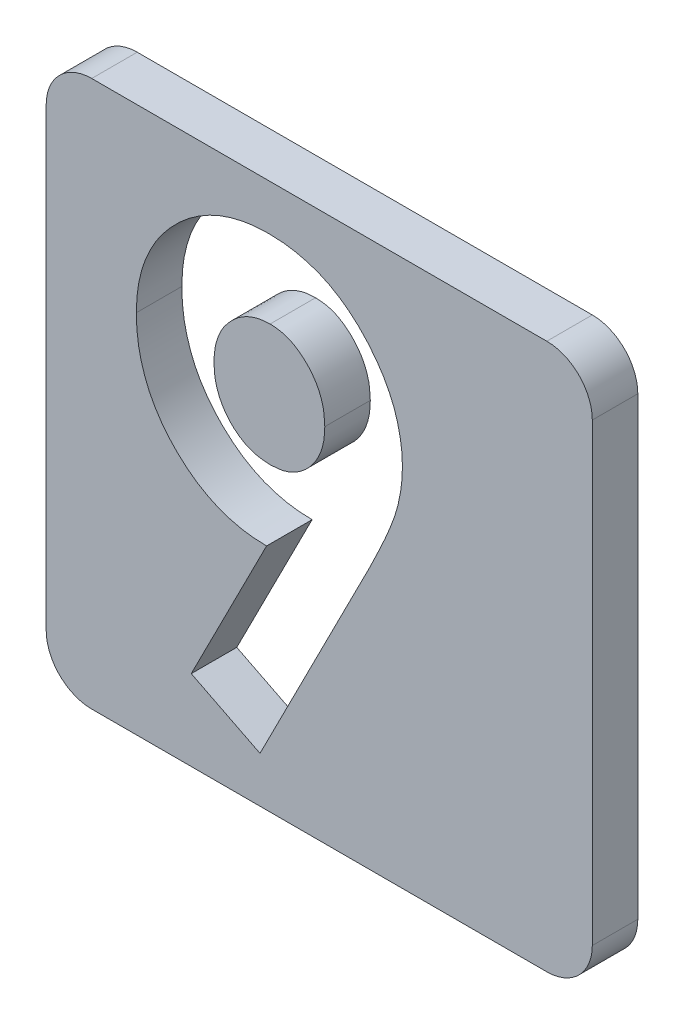
from build123d import *

# Parameters (mm, degrees)
BOSS_EXTRUDE1_DEPTH = 10
CUT_EXTRUDE8_DEPTH  = 10


with BuildPart() as part:
    # Sketch1 → Boss-Extrude1 (new body)
    with BuildSketch(Plane.XY):
        with BuildLine():
            Line((-50, 60), (50, 60))
            ThreePointArc((50, 60), (57.071067812, 57.071067812), (60, 50))
            Line((60, 50), (60, -50))
            ThreePointArc((60, -50), (57.071067812, -57.071067812), (50, -60))
            Line((50, -60), (-50, -60))
            ThreePointArc((-50, -60), (-57.071067812, -57.071067812), (-60, -50))
            Line((-60, -50), (-60, 50))
            ThreePointArc((-60, 50), (-57.071067812, 57.071067812), (-50, 60))
        make_face()
    extrude(amount=BOSS_EXTRUDE1_DEPTH)

    # Sketch2 → Cut-Extrude8 (cut)
    with BuildSketch(Plane.XY.offset(10)):
        with BuildLine():
            Line((-13.016826923, -49.935897436), (-28.127003205, -42.323717949))
            Line((-28.127003205, -42.323717949), (-11.570512821, -9.743589744))
            add(Edge.make_bspline(
                [(-11.570512821, -9.743589744), (-12.548708278, -9.718656842), (-14.469142635, -9.669707523), (-17.296832406, -9.262939126), (-20.000884053, -8.568559514), (-22.613169441, -7.64416532), (-25.097561488, -6.404919118), (-27.484185435, -4.925943808), (-29.740002339, -3.148976233), (-31.875588777, -1.151591204), (-33.825447448, 1.056165786), (-35.517883527, 3.430571064), (-36.993036242, 5.911392925), (-38.140195905, 8.554637717), (-39.061600382, 11.311041924), (-39.734824953, 14.194872996), (-40.112620777, 17.218783333), (-40.165425938, 19.276823637), (-40.192307692, 20.324519231)],
                knots=[0, 0, 0, 0, 1.014336294, 1.991387562, 2.955278539, 3.906441712, 4.859855302, 5.829322156, 6.813833455, 7.833278715, 8.858926674, 9.863225732, 10.85404919, 11.846815163, 12.845559416, 13.865450493, 14.913355531, 16, 16, 16, 16], degree=3))
            add(Edge.make_bspline(
                [(-40.192307692, 20.324519231), (-40.1673734, 21.340773633), (-40.118240892, 23.343281906), (-39.710190668, 26.282312375), (-39.038645608, 29.104211007), (-38.117309844, 31.808498403), (-36.890777483, 34.376939083), (-35.455152573, 36.849748868), (-33.70016626, 39.175767992), (-31.717628771, 41.365065794), (-29.547846705, 43.367886729), (-27.245890069, 45.128855775), (-24.822225522, 46.600856692), (-22.307999558, 47.837065907), (-19.657765713, 48.76068453), (-16.909822836, 49.457547936), (-14.043700567, 49.859737715), (-12.098236548, 49.910307721), (-11.113782051, 49.935897436)],
                knots=[0, 0, 0, 0, 1.055538678, 2.079917126, 3.075849687, 4.065898488, 5.041806164, 6.028602842, 7.031727914, 8.062953097, 9.093756959, 10.095582084, 11.068815425, 12.035667573, 13.000833448, 13.979119574, 14.977382875, 16, 16, 16, 16], degree=3))
            add(Edge.make_bspline(
                [(-11.113782051, 49.935897436), (-10.084415788, 49.914709044), (-8.060306309, 49.873044939), (-5.097281847, 49.413297973), (-2.262379974, 48.707962029), (0.455917975, 47.749971924), (3.023865475, 46.449781068), (5.462949791, 44.891493271), (7.765057752, 43.040630392), (9.905466416, 40.950540036), (11.852144175, 38.677175718), (13.577631788, 36.297511709), (15.027114637, 33.816200927), (16.214329754, 31.255388219), (17.139164354, 28.611061763), (17.774870277, 25.87947069), (18.196908504, 23.065286139), (18.244928031, 21.15706104), (18.269230769, 20.19130609)],
                knots=[0, 0, 0, 0, 1.062826075, 2.08990367, 3.089830715, 4.078784409, 5.060762809, 6.057138927, 7.064407536, 8.107320944, 9.143871033, 10.153461498, 11.140480137, 12.108246174, 13.065926856, 14.029354859, 15.002654194, 16, 16, 16, 16], degree=3))
            add(Edge.make_bspline(
                [(18.269230769, 20.19130609), (18.255968539, 19.454747721), (18.229255424, 17.971153561), (17.966591792, 15.746343301), (17.568078138, 13.515366757), (17.105518687, 11.639668813), (16.620589451, 10.058569374), (16.14869808, 8.71729972), (15.54324756, 7.228238571), (14.867201538, 5.581405091), (14.084260677, 3.784020843), (13.178192139, 1.844678009), (12.203756224, -0.265385795), (11.485500766, -1.708218659), (11.113782051, -2.454927885)],
                knots=[0, 0, 0, 0, 1.105131805, 2.225983929, 3.357782449, 4.505488967, 5.122909461, 5.839607681, 6.638776516, 7.535249922, 8.51168636, 9.581005249, 10.748097757, 12, 12, 12, 12], degree=3))
            Line((11.113782051, -2.454927885), (-13.016826923, -49.935897436))
        make_face()
        with BuildLine():
            add(Edge.make_bspline(
                [(-10.733173077, 6.08974359), (-9.916146682, 6.137844301), (-8.319862096, 6.2318222), (-6.026905446, 6.958479343), (-3.974825826, 8.201987058), (-2.155993164, 9.85400362), (-0.652965525, 11.869539394), (0.439833923, 14.164047711), (1.112964745, 16.690011833), (1.182281853, 18.448924336), (1.217948718, 19.353966346)],
                knots=[0, 0, 0, 0, 0.984774978, 1.924027336, 2.867853169, 3.859505234, 4.871392407, 5.881338128, 6.909850265, 8, 8, 8, 8], degree=3))
            add(Edge.make_bspline(
                [(1.217948718, 19.353966346), (1.174991867, 20.277835319), (1.091430535, 22.074981053), (0.411851392, 24.661577988), (-0.749412668, 26.999708209), (-2.329245998, 29.032187271), (-4.173680809, 30.733112591), (-6.236224491, 31.975592732), (-8.466794198, 32.743902628), (-10.010426476, 32.837387258), (-10.790264423, 32.884615385)],
                knots=[0, 0, 0, 0, 1.104110315, 2.147758178, 3.172670271, 4.206310416, 5.210906102, 6.157051016, 7.068948237, 8, 8, 8, 8], degree=3))
            add(Edge.make_bspline(
                [(-10.790264423, 32.884615385), (-11.614509362, 32.838574056), (-13.232907553, 32.748172283), (-15.554343685, 31.981707424), (-17.694343378, 30.763087041), (-19.563156483, 29.05639056), (-21.180542563, 27.050678592), (-22.30839003, 24.704656139), (-23.021905441, 22.136109489), (-23.10060496, 20.3357409), (-23.141025641, 19.411057692)],
                knots=[0, 0, 0, 0, 0.970967322, 1.90648639, 2.855811969, 3.858352357, 4.877096915, 5.878517833, 6.91039038, 8, 8, 8, 8], degree=3))
            add(Edge.make_bspline(
                [(-23.141025641, 19.411057692), (-23.098803739, 18.499555164), (-23.016686547, 16.726777924), (-22.328460975, 14.186488067), (-21.20741048, 11.879837023), (-19.67485448, 9.848405883), (-17.787122896, 8.188249657), (-15.643749014, 6.957987809), (-13.252865032, 6.229851869), (-11.588189493, 6.137287052), (-10.733173077, 6.08974359)],
                knots=[0, 0, 0, 0, 1.075706617, 2.092137047, 3.084482865, 4.090466434, 5.0784141, 6.035155512, 6.990809768, 8, 8, 8, 8], degree=3))
        make_face(mode=Mode.SUBTRACT)
    extrude(amount=-CUT_EXTRUDE8_DEPTH, mode=Mode.SUBTRACT)


with BuildPart() as cut_extrude8_piece_1:
    # of the separate pieces the step leaves, piece 1, a body of its own (cut_extrude8_pieces)
    add(part.part.solids().sort_by_distance((-50, 60, 0))[0])


with BuildPart() as cut_extrude8_piece_2:
    # of the separate pieces the step leaves, piece 2, a body of its own (cut_extrude8_pieces)
    add(part.part.solids().sort_by_distance((-10.733173077, 6.08974359, 0))[0])


solid = Compound([cut_extrude8_piece_1.part, cut_extrude8_piece_2.part])
